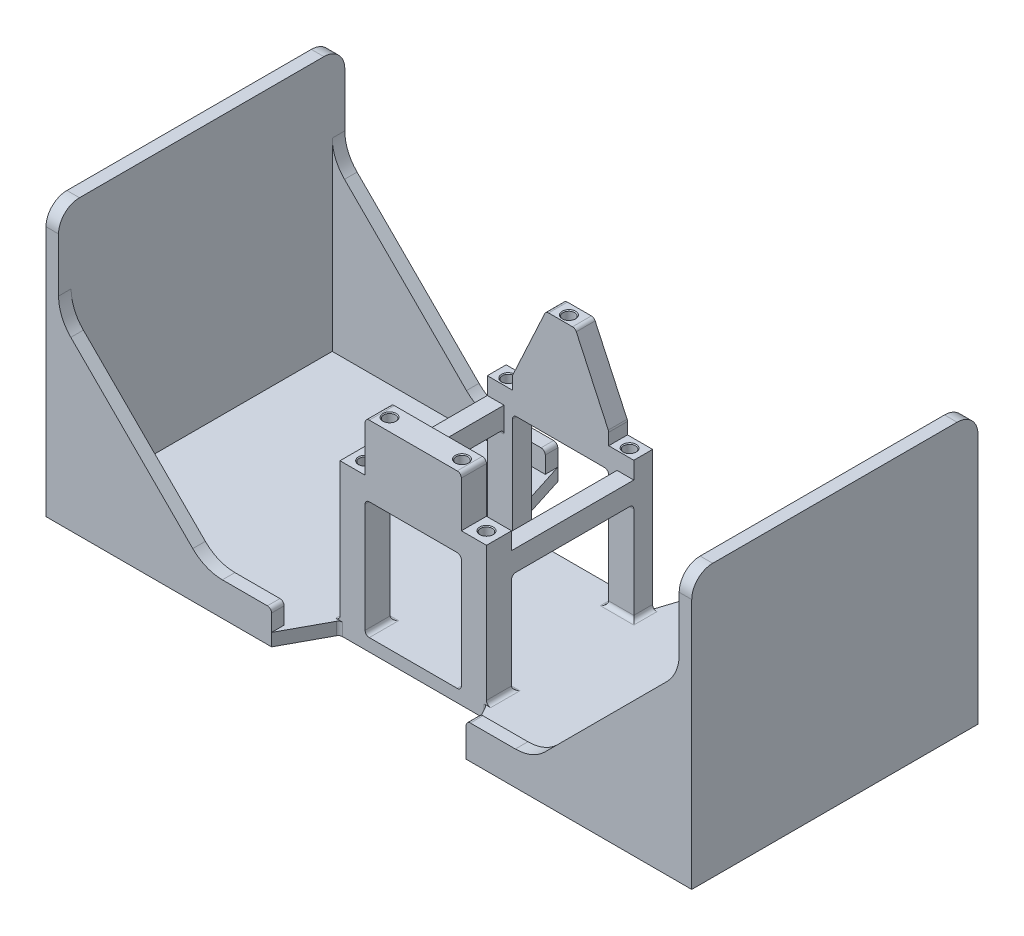
from build123d import *

# Parameters (mm, degrees)
SKETCH1_W           = 154.3
SKETCH1_H           = 68.4
BOSS_EXTRUDE1_DEPTH = 3
SKETCH2_W           = 23
SKETCH2_H           = 4.5
SKETCH2_R           = 1.4
SKETCH2_H_2         = 6
BOSS_EXTRUDE2_DEPTH = 45
BOSS_EXTRUDE3_START = 45
SKETCH2_3_W         = 23
SKETCH2_3_H         = 4.5
SKETCH2_3_R         = 1.4
BOSS_EXTRUDE3_DEPTH = 8.4
BOSS_EXTRUDE4_DEPTH = 29
SKETCH3_W           = 2
SKETCH3_H           = 29.2
CUT_EXTRUDE1_DEPTH  = 29
BOSS_EXTRUDE5_DEPTH = 62
SKETCH4_3_W         = 50.9
SKETCH4_3_H         = 3
BOSS_EXTRUDE6_DEPTH = 5
CUT_EXTRUDE2_DEPTH  = 105.717536736
FILLET1_R           = 5
FILLET2_R           = 1
SKETCH6_W           = 6
SKETCH6_H           = 6
SKETCH6_R           = 1.4
SKETCH6_H_2         = 4.5
BOSS_EXTRUDE7_DEPTH = 4.1
SKETCH8_W           = 29.2
SKETCH8_H           = 24
CUT_EXTRUDE4_DEPTH  = 40
SKETCH9_W           = 23
SKETCH9_H           = 28.1
CUT_EXTRUDE5_DEPTH  = 40
CUT_EXTRUDE6_REACH  = 114.726
FILLET3_R           = 1
CHAMFER1_SIZE       = 0.2
CHAMFER2_SIZE       = 35
FILLET4_R           = 10


with BuildPart() as part:
    # Sketch1 → Boss-Extrude1 (new body)
    with BuildSketch(Plane(origin=(0, 0, 0), x_dir=(1, 0, 0), z_dir=(0, 1, 0))):
        Rectangle(SKETCH1_W, SKETCH1_H)
    extrude(amount=BOSS_EXTRUDE1_DEPTH)

    # Sketch2 → Boss-Extrude2 (add)
    # profile 1 of 2: a face of its own
    with BuildSketch(Plane(origin=(0, 3, 0), x_dir=(1, 0, 0), z_dir=(0, 1, 0))):
        with Locations((0, 13.85)):
            Rectangle(SKETCH2_W, SKETCH2_H)
        with Locations(Location((0, 13.6, 0), (0, 0, 90))):
            Circle(SKETCH2_R, mode=Mode.SUBTRACT)
    # profile 2 of 2: a face of its own
    with BuildSketch(Plane(origin=(0, 3, 0), x_dir=(1, 0, 0), z_dir=(0, 1, 0))):
        with Locations((0, -20.6)):
            Rectangle(SKETCH2_W, SKETCH2_H_2)
        with Locations(Location((8.65, -20.6, 0), (0, 0, 90))):
            Circle(SKETCH2_R, mode=Mode.SUBTRACT)
        with Locations(Location((-8.65, -20.6, 0), (0, 0, 90))):
            Circle(SKETCH2_R, mode=Mode.SUBTRACT)
    extrude(amount=BOSS_EXTRUDE2_DEPTH)

    # Sketch2<3> → Boss-Extrude3 (add)
    with BuildSketch(Plane(origin=(0, 3, 0), x_dir=(1, 0, 0), z_dir=(0, 1, 0)).offset(BOSS_EXTRUDE3_START)):
        with Locations((0, 13.85)):
            Rectangle(SKETCH2_3_W, SKETCH2_3_H)
        with Locations(Location((0, 13.6, 0), (0, 0, 90))):
            Circle(SKETCH2_3_R, mode=Mode.SUBTRACT)
    extrude(amount=BOSS_EXTRUDE3_DEPTH)

    # Sketch2<5> → Boss-Extrude4 (add)
    with BuildSketch(Plane(origin=(0, 3, 0), x_dir=(1, 0, 0), z_dir=(0, 1, 0))):
        Polygon((-11.5, -17.6), (-11.5, 11.6), (-11.5, 16.1), (-17.5, 16.1), (-17.5, -23.6), (-11.5, -23.6), align=None)
        Polygon((11.5, 16.1), (11.5, 11.6), (11.5, -17.6), (11.5, -23.6), (17.5, -23.6), (17.5, 16.1), align=None)
    extrude(amount=BOSS_EXTRUDE4_DEPTH)

    # Sketch3 → Cut-Extrude1 (cut)
    with BuildSketch(Plane(origin=(0, 32, 0), x_dir=(1, 0, 0), z_dir=(0, 1, 0))):
        with Locations((12.5, -3)):
            Rectangle(SKETCH3_W, SKETCH3_H)
        with Locations((-12.5, -3)):
            Rectangle(SKETCH3_W, SKETCH3_H)
    extrude(amount=-CUT_EXTRUDE1_DEPTH, mode=Mode.SUBTRACT)

    # Sketch4 → Boss-Extrude5 (add)
    with BuildSketch(Plane(origin=(0, 3, 0), x_dir=(1, 0, 0), z_dir=(0, 1, 0))):
        Polygon((77.15, -34.2), (77.15, 34.2), (74.15, 34.2), (74.15, 31.2), (74.15, -31.2), (74.15, -34.2), align=None)
        Polygon((-74.15, 31.2), (-74.15, 34.2), (-77.15, 34.2), (-77.15, -34.2), (-74.15, -34.2), (-74.15, -31.2), align=None)
    extrude(amount=BOSS_EXTRUDE5_DEPTH)

    # Sketch4<3> → Boss-Extrude6 (add)
    with BuildSketch(Plane(origin=(0, 3, 0), x_dir=(1, 0, 0), z_dir=(0, 1, 0))):
        with Locations((48.7, 32.7)):
            Rectangle(SKETCH4_3_W, SKETCH4_3_H)
        with Locations((48.7, -32.7)):
            Rectangle(SKETCH4_3_W, SKETCH4_3_H)
        with Locations((-48.7, 32.7)):
            Rectangle(SKETCH4_3_W, SKETCH4_3_H)
        with Locations((-48.7, -32.7)):
            Rectangle(SKETCH4_3_W, SKETCH4_3_H)
    extrude(amount=BOSS_EXTRUDE6_DEPTH)

    # Sketch5 → Cut-Extrude2 (cut, through all)
    with BuildSketch(Plane(origin=(0, 3, 0), x_dir=(1, 0, 0), z_dir=(0, 1, 0))):
        Polygon((23.25, -34.2), (17.5, -23.6), (-17.5, -23.6), (-23.25, -34.2), align=None)
        Polygon((17.5, 16.1), (23.25, 34.2), (-23.25, 34.2), (-17.5, 16.1), align=None)
    extrude(amount=-CUT_EXTRUDE2_DEPTH, mode=Mode.SUBTRACT)

    # Fillet1
    fillet1_edges = [part.edges().sort_by_distance(p)[0] for p in [
        (75.65, 65, -34.2),
        (75.65, 65, 34.2),
        (-75.65, 65, -34.2),
        (-75.65, 65, 34.2),
    ]]
    fillet(fillet1_edges, radius=FILLET1_R)

    # Fillet2
    fillet2_edges = [part.edges().sort_by_distance(p)[0] for p in [
        (23.25, 8, -32.7),
        (23.25, 8, 32.7),
        (-23.25, 8, -32.7),
        (-23.25, 8, 32.7),
        (-17.5, 1.5, 23.6),
        (17.5, 1.5, 23.6),
        (17.5, 1.5, -16.1),
        (-17.5, 1.5, -16.1),
    ]]
    fillet(fillet2_edges, radius=FILLET2_R)

    # Sketch6 → Boss-Extrude7 (add)
    # profile 1 of 4: a face of its own
    with BuildSketch(Plane(origin=(0, 32, 0), x_dir=(1, 0, 0), z_dir=(0, 1, 0))):
        with Locations((-14.5, -20.6)):
            Rectangle(SKETCH6_W, SKETCH6_H)
        with Locations(Location((-14.5, -20.6, 0), (0, 0, 270))):
            Circle(SKETCH6_R, mode=Mode.SUBTRACT)
    # profile 2 of 4: a face of its own
    with BuildSketch(Plane(origin=(0, 32, 0), x_dir=(1, 0, 0), z_dir=(0, 1, 0))):
        with Locations((14.5, -20.6)):
            Rectangle(SKETCH6_W, SKETCH6_H)
        with Locations(Location((14.5, -20.6, 0), (0, 0, 270))):
            Circle(SKETCH6_R, mode=Mode.SUBTRACT)
    # profile 3 of 4: a face of its own
    with BuildSketch(Plane(origin=(0, 32, 0), x_dir=(1, 0, 0), z_dir=(0, 1, 0))):
        with Locations((14.5, 13.85)):
            Rectangle(SKETCH6_W, SKETCH6_H_2)
        with Locations(Location((14.5, 13.6, 0), (0, 0, 270))):
            Circle(SKETCH6_R, mode=Mode.SUBTRACT)
    # profile 4 of 4: a face of its own
    with BuildSketch(Plane(origin=(0, 32, 0), x_dir=(1, 0, 0), z_dir=(0, 1, 0))):
        with Locations((-14.5, 13.85)):
            Rectangle(SKETCH6_W, SKETCH6_H_2)
        with Locations(Location((-14.5, 13.6, 0), (0, 0, 270))):
            Circle(SKETCH6_R, mode=Mode.SUBTRACT)
    extrude(amount=BOSS_EXTRUDE7_DEPTH)

    # Sketch8 → Cut-Extrude4 (cut)
    with BuildSketch(Plane(origin=(17.5, 0, 0), x_dir=(0, 0, -1), z_dir=(1, 0, 0))):
        with Locations((-3, 15)):
            Rectangle(SKETCH8_W, SKETCH8_H)
    extrude(amount=-CUT_EXTRUDE4_DEPTH, mode=Mode.SUBTRACT)

    # Sketch9 → Cut-Extrude5 (cut)
    with BuildSketch(Plane.XY.offset(23.6)):
        with Locations((0, 17.05)):
            Rectangle(SKETCH9_W, SKETCH9_H)
    extrude(amount=-CUT_EXTRUDE5_DEPTH, mode=Mode.SUBTRACT)

    # Sketch10 → Cut-Extrude6 (cut, up to next)
    with BuildSketch(Plane(origin=(0, 0, -16.1), x_dir=(-1, 0, 0), z_dir=(0, 0, -1)), mode=Mode.PRIVATE) as cut_extrude6_sk1:
        Polygon((-11.5, 39.1), (-3.5, 56.4), (-11.5, 56.4), align=None)
    cut_extrude6_tool1 = extrude(cut_extrude6_sk1.sketch, amount=-CUT_EXTRUDE6_REACH, mode=Mode.PRIVATE) & part.part
    # Sketch10 → Cut-Extrude6 (cut, up to next)
    with BuildSketch(Plane(origin=(0, 0, -16.1), x_dir=(-1, 0, 0), z_dir=(0, 0, -1)), mode=Mode.PRIVATE) as cut_extrude6_sk2:
        Polygon((11.5, 56.4), (3.5, 56.4), (11.5, 39.1), align=None)
    cut_extrude6_tool2 = extrude(cut_extrude6_sk2.sketch, amount=-CUT_EXTRUDE6_REACH, mode=Mode.PRIVATE) & part.part
    add(cut_extrude6_tool1.solids().sort_by_distance((8.833333, 50.633333, -16.1))[0], mode=Mode.SUBTRACT)
    add(cut_extrude6_tool2.solids().sort_by_distance((-8.833333, 50.633333, -16.1))[0], mode=Mode.SUBTRACT)

    # Fillet3
    fillet3_edges = [part.edges().sort_by_distance(p)[0] for p in [
        (-14.5, 3, -11.6),
        (-11.5, 48, 20.6),
        (11.5, 48, 20.6),
        (-14.5, 3, 17.6),
        (17.5, 3, 20.6),
        (-17.5, 3, 20.6),
        (-15.5, 27, 17.6),
        (15.5, 27, 17.6),
        (-15.5, 27, -11.6),
        (15.5, 27, -11.6),
        (14.5, 3, 17.6),
        (14.5, 3, -11.6),
        (-11.5, 3, -13.85),
        (11.5, 31.1, -13.85),
        (-11.5, 31.1, -13.85),
        (11.5, 3, -13.85),
        (-11.5, 3, 20.6),
        (-11.5, 31.1, 20.6),
        (11.5, 31.1, 20.6),
        (11.5, 3, 20.6),
        (3.5, 56.4, -13.85),
        (11.5, 39.1, -13.85),
        (-11.5, 39.1, -13.85),
        (-3.5, 56.4, -13.85),
        (-17.5, 3, -13.85),
        (17.5, 3, -13.85),
    ]]
    fillet(fillet3_edges, radius=FILLET3_R)

    # Chamfer1
    chamfer1_edges = [part.edges().sort_by_distance(p)[0] for p in [
        (-8.65, 48, 22),
        (8.65, 48, 22),
        (-14.5, 32, 19.2),
        (-14.5, 36.1, 19.2),
        (14.5, 32, 19.2),
        (14.5, 36.1, 19.2),
        (-14.5, 32, -15),
        (-14.5, 36.1, -15),
        (14.5, 32, -15),
        (14.5, 36.1, -15),
        (-8.65, 31.1, 22),
        (8.65, 31.1, 22),
        (0, 31.1, -12.2),
        (0, 56.4, -12.2),
    ]]
    chamfer(chamfer1_edges, length=CHAMFER1_SIZE)

    # Chamfer2
    chamfer2_edges = [part.edges().sort_by_distance(p)[0] for p in [
        (74.15, 8, -32.7),
        (74.15, 8, 32.7),
        (-74.15, 8, -32.7),
        (-74.15, 8, 32.7),
    ]]
    chamfer(chamfer2_edges, length=CHAMFER2_SIZE)

    # Fillet4
    fillet4_edges = [part.edges().sort_by_distance(p)[0] for p in [
        (74.15, 43, 32.7),
        (74.15, 43, -32.7),
        (39.15, 8, -32.7),
        (39.15, 8, 32.7),
        (-39.15, 8, -32.7),
        (-74.15, 43, 32.7),
        (-74.15, 43, -32.7),
        (-39.15, 8, 32.7),
    ]]
    fillet(fillet4_edges, radius=FILLET4_R)


solid = part.part
